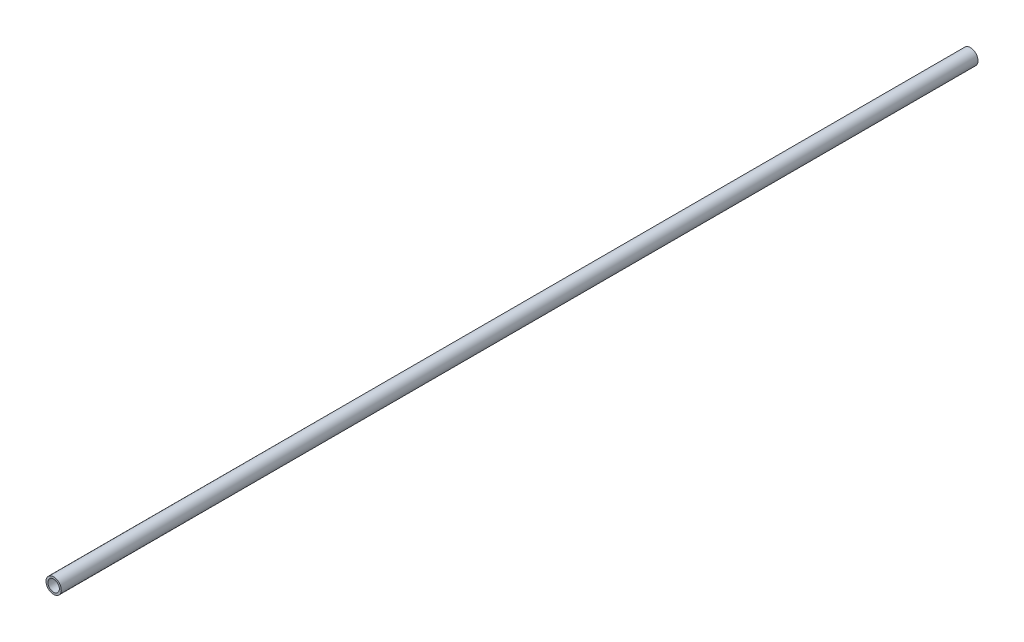
from build123d import *

# Parameters (mm, degrees)
SKETCH1_R           = 12.7
SKETCH1_R_2         = 9.525
BOSS_EXTRUDE1_DEPTH = 1524


with BuildPart() as part:
    # Sketch1 → Boss-Extrude1 (new body)
    with BuildSketch(Plane.XY):
        Circle(SKETCH1_R)
        Circle(SKETCH1_R_2, mode=Mode.SUBTRACT)
    extrude(amount=BOSS_EXTRUDE1_DEPTH)


solid = part.part
